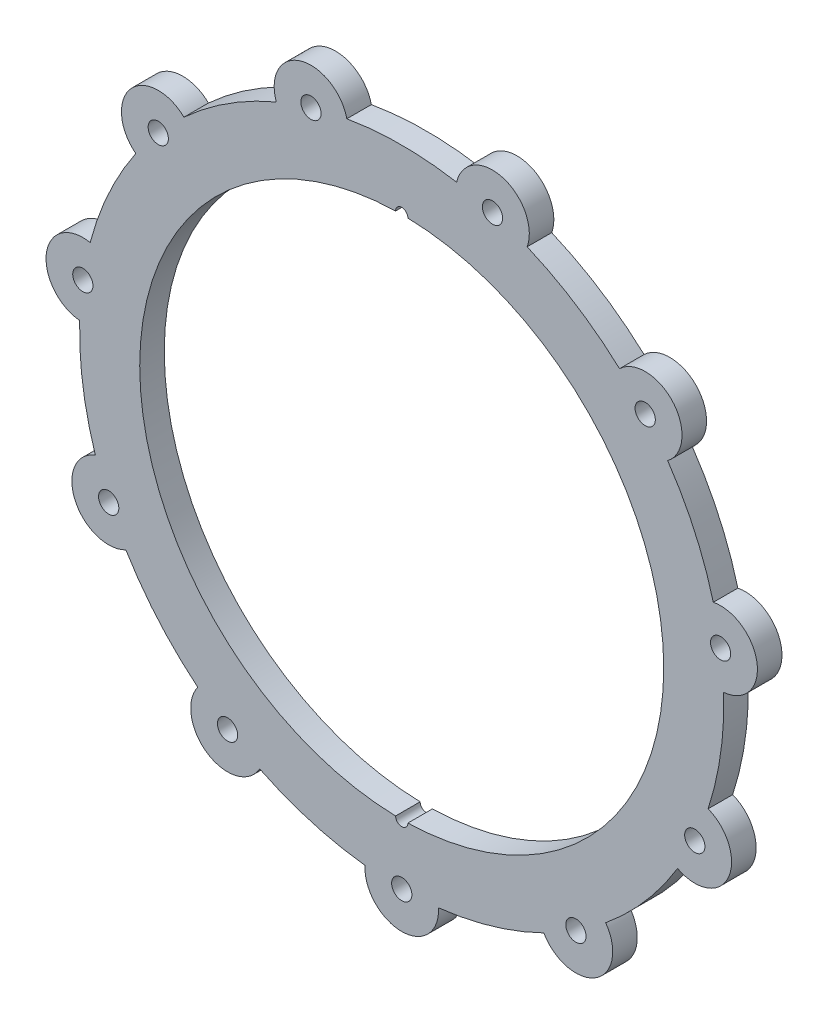
from build123d import *

# Parameters (mm, degrees)
SKETCH_1_R          = 42.7
SKETCH_1_R_2        = 1.65
EXTRUDE_1_DEPTH     = 4
SKETCH_2_R          = 1
CUT_EXTRUDE_1_DEPTH = 4


with BuildPart() as part:
    # 草图1 → 凸台-拉伸1 (new body)
    with BuildSketch(Plane.XY):
        with BuildLine():
            ThreePointArc((-57.90455435, 8.325418039), (-56.664135325, 3.740040393), (-52.478752132, 1.493510837))
            ThreePointArc((-52.478752132, 1.493510837), (-51.965625699, -7.471529009), (-49.932223308, -16.217986173))
            ThreePointArc((-49.932223308, -16.217986173), (-53.315148558, -19.552674205), (-53.213471728, -24.301778261))
            ThreePointArc((-53.213471728, -24.301778261), (-49.690922522, -27.488622249), (-44.95538855, -27.115734184))
            ThreePointArc((-44.95538855, -27.115734184), (-39.676852654, -34.380188532), (-33.237553958, -40.63883619))
            ThreePointArc((-33.237553958, -40.63883619), (-34.280583312, -45.27310175), (-31.627487821, -49.213331671))
            ThreePointArc((-31.627487821, -49.213331671), (-26.941192918, -49.989841552), (-23.159006743, -47.115925192))
            ThreePointArc((-23.159006743, -47.115925192), (-14.790959234, -50.373381115), (-5.990196072, -52.157142857))
            ThreePointArc((-5.990196072, -52.157142857), (-4.36217508, -56.619639374), (0, -58.5))
            ThreePointArc((0, -58.5), (4.36217508, -56.619639374), (5.990196072, -52.157142857))
            ThreePointArc((5.990196072, -52.157142857), (14.790959234, -50.373381115), (23.159006743, -47.115925192))
            ThreePointArc((23.159006743, -47.115925192), (26.941192918, -49.989841552), (31.627487821, -49.213331671))
            ThreePointArc((31.627487821, -49.213331671), (34.280583312, -45.27310175), (33.237553958, -40.63883619))
            ThreePointArc((33.237553958, -40.63883619), (39.676852654, -34.380188532), (44.95538855, -27.115734184))
            ThreePointArc((44.95538855, -27.115734184), (49.690922522, -27.488622249), (53.213471728, -24.301778261))
            ThreePointArc((53.213471728, -24.301778261), (53.315148558, -19.552674205), (49.932223308, -16.217986173))
            ThreePointArc((49.932223308, -16.217986173), (51.965625699, -7.471529009), (52.478752132, 1.493510837))
            ThreePointArc((52.478752132, 1.493510837), (56.664135325, 3.740040393), (57.90455435, 8.325418039))
            ThreePointArc((57.90455435, 8.325418039), (55.422530843, 12.375589248), (50.773764562, 13.351959864))
            ThreePointArc((50.773764562, 13.351959864), (47.755679756, 21.809288183), (43.34048271, 29.62857672))
            ThreePointArc((43.34048271, 29.62857672), (45.646885531, 33.781266636), (44.2113501, 38.309352936))
            ThreePointArc((44.2113501, 38.309352936), (39.933651182, 40.374690556), (35.494994318, 38.682752984))
            ThreePointArc((35.494994318, 38.682752984), (28.383642916, 44.165810474), (20.441916256, 48.35677884))
            ThreePointArc((20.441916256, 48.35677884), (20.137072107, 53.097179409), (16.481354575, 56.130338956))
            ThreePointArc((16.481354575, 56.130338956), (11.766119429, 55.555112887), (8.946814173, 51.732045351))
            ThreePointArc((8.946814173, 51.732045351), (0, 52.5), (-8.946814173, 51.732045351))
            ThreePointArc((-8.946814173, 51.732045351), (-11.766119429, 55.555112887), (-16.481354575, 56.130338956))
            ThreePointArc((-16.481354575, 56.130338956), (-20.137072107, 53.097179409), (-20.441916256, 48.35677884))
            ThreePointArc((-20.441916256, 48.35677884), (-28.383642916, 44.165810474), (-35.494994318, 38.682752984))
            ThreePointArc((-35.494994318, 38.682752984), (-39.933651182, 40.374690556), (-44.2113501, 38.309352936))
            ThreePointArc((-44.2113501, 38.309352936), (-45.646885531, 33.781266636), (-43.34048271, 29.62857672))
            ThreePointArc((-43.34048271, 29.62857672), (-47.755679756, 21.809288183), (-50.773764562, 13.351959864))
            ThreePointArc((-50.773764562, 13.351959864), (-55.422530843, 12.375589248), (-57.90455435, 8.325418039))
        make_face()
        Circle(SKETCH_1_R, mode=Mode.SUBTRACT)
        with Locations((-51.965625699, 7.471529009)):
            Circle(SKETCH_1_R_2, mode=Mode.SUBTRACT)
        with Locations((-39.676852654, 34.380188532)):
            Circle(SKETCH_1_R_2, mode=Mode.SUBTRACT)
        with Locations((-14.790959234, 50.373381115)):
            Circle(SKETCH_1_R_2, mode=Mode.SUBTRACT)
        with Locations((14.790959234, 50.373381115)):
            Circle(SKETCH_1_R_2, mode=Mode.SUBTRACT)
        with Locations((39.676852654, 34.380188532)):
            Circle(SKETCH_1_R_2, mode=Mode.SUBTRACT)
        with Locations((51.965625699, 7.471529009)):
            Circle(SKETCH_1_R_2, mode=Mode.SUBTRACT)
        with Locations((47.755679756, -21.809288183)):
            Circle(SKETCH_1_R_2, mode=Mode.SUBTRACT)
        with Locations((28.383642916, -44.165810474)):
            Circle(SKETCH_1_R_2, mode=Mode.SUBTRACT)
        with Locations((0, -52.5)):
            Circle(SKETCH_1_R_2, mode=Mode.SUBTRACT)
        with Locations((-28.383642916, -44.165810474)):
            Circle(SKETCH_1_R_2, mode=Mode.SUBTRACT)
        with Locations((-47.755679756, -21.809288183)):
            Circle(SKETCH_1_R_2, mode=Mode.SUBTRACT)
    extrude(amount=EXTRUDE_1_DEPTH)

    # 草图2 → 切除-拉伸1 (cut)
    with BuildSketch(Plane.XY.offset(4)):
        with Locations((0, -42.7)):
            Circle(SKETCH_2_R)
        with Locations((0, 42.7)):
            Circle(SKETCH_2_R)
    extrude(amount=-CUT_EXTRUDE_1_DEPTH, mode=Mode.SUBTRACT)


solid = part.part
